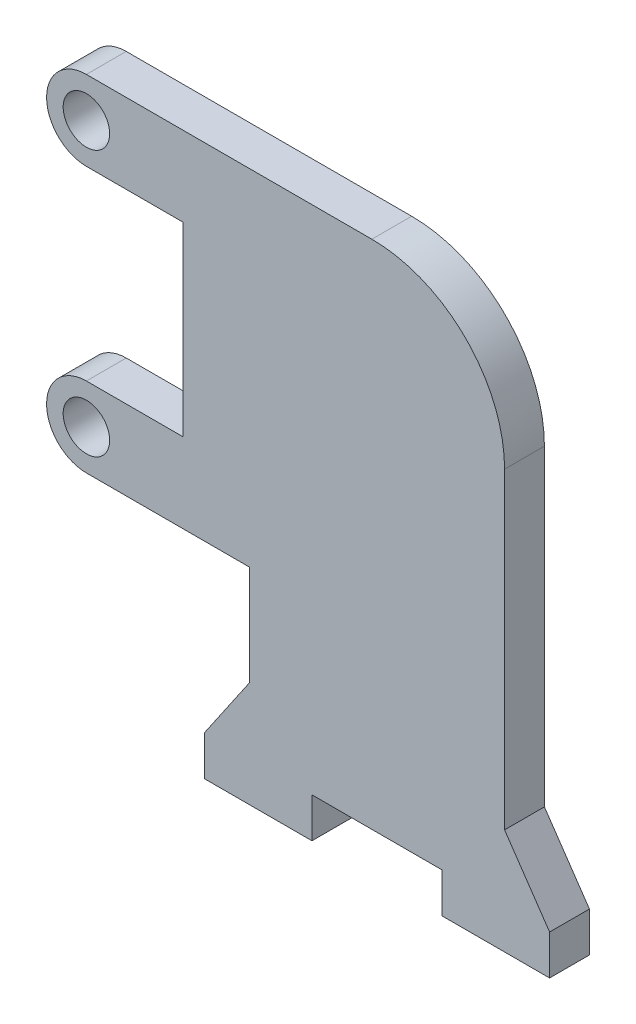
from build123d import *

# Parameters (mm, degrees)
SKETCH1_R           = 1.75
BOSS_EXTRUDE1_DEPTH = 3
FILLET1_R           = 10


with BuildPart() as part:
    # Sketch1 → Boss-Extrude1 (new body)
    with BuildSketch(Plane.XY):
        with BuildLine():
            Line((0, 43.5), (0, 9.968037932))
            Line((0, 9.968037932), (3.389895868, 5))
            Line((3.389895868, 5), (3.389895868, 2))
            Line((3.389895868, 2), (-4.710104132, 2))
            Line((-4.710104132, 2), (-4.710104132, 5))
            Line((-4.710104132, 5), (-14.510104132, 5))
            Line((-14.510104132, 5), (-14.510104132, 2))
            Line((-14.510104132, 2), (-22.610104132, 2))
            Line((-22.610104132, 2), (-22.610104132, 5))
            Line((-22.610104132, 5), (-19.210104132, 9.968037932))
            Line((-19.210104132, 9.968037932), (-19.210104132, 17.5))
            Line((-19.210104132, 17.5), (-31.5, 17.5))
            ThreePointArc((-31.5, 17.5), (-34.5, 20.5), (-31.5, 23.5))
            Line((-31.5, 23.5), (-24.207476636, 23.5))
            Line((-24.207476636, 23.5), (-24.207476636, 37.5))
            Line((-24.207476636, 37.5), (-31.5, 37.5))
            ThreePointArc((-31.5, 37.5), (-34.5, 40.5), (-31.5, 43.5))
            Line((-31.5, 43.5), (0, 43.5))
        make_face()
        with Locations((-31.5, 40.5)):
            Circle(SKETCH1_R, mode=Mode.SUBTRACT)
        with Locations((-31.5, 20.5)):
            Circle(SKETCH1_R, mode=Mode.SUBTRACT)
    extrude(amount=BOSS_EXTRUDE1_DEPTH)

    # Fillet1
    fillet1_edges = [part.edges().sort_by_distance(p)[0] for p in [
        (0, 43.5, 1.5),
    ]]
    fillet(fillet1_edges, radius=FILLET1_R)


solid = part.part
